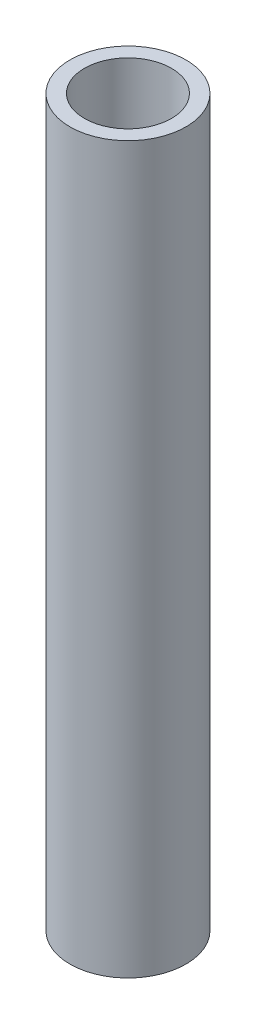
from build123d import *

# Parameters (mm, degrees)
SKETCH2_R   = 4
SKETCH2_R_2 = 3


with BuildPart() as part:
    # Sweep1: sweep along a path in Sketch1
    with BuildLine(Plane.XY) as sweep1_path:
        Line((0, 0), (0, 50))
    # Sketch2 → Sweep1 (sweep)
    with BuildSketch(Plane(origin=(0, 0, 0), x_dir=(1, 0, 0), z_dir=(0, 1, 0))):
        Circle(SKETCH2_R)
        Circle(SKETCH2_R_2, mode=Mode.SUBTRACT)
    sweep(path=sweep1_path.line)


solid = part.part
